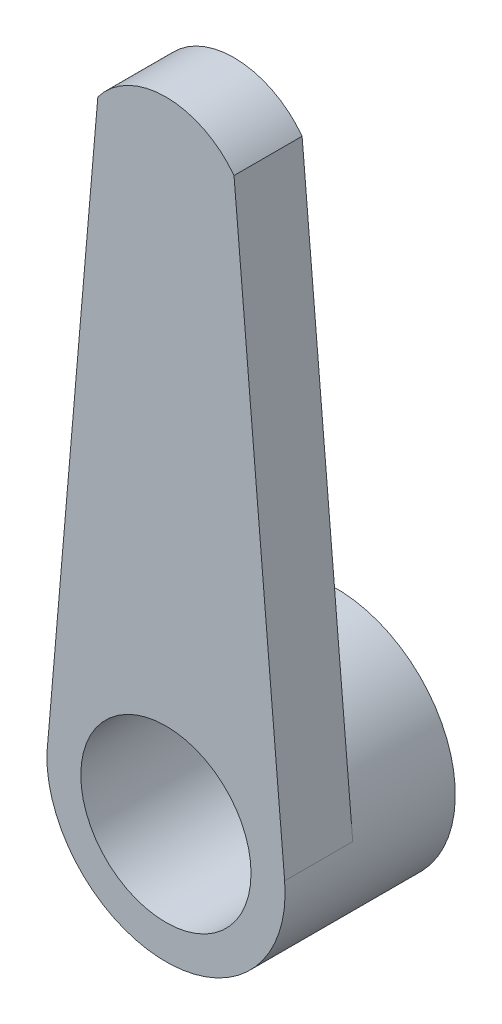
from build123d import *
from build123d.topology import SkipClean

# Parameters (mm, degrees)
BOSS_EXTRUDE1_DEPTH      = 2
BOSS_EXTRUDE2_START      = 3
BOSS_EXTRUDE2_DEPTH      = 3
F_5_0_5_DIAMETER_HOLE1_D = 5


with BuildPart() as part:
    # Sketch1 → Boss-Extrude1 (new body)
    with BuildSketch(Plane(origin=(0, 0, -2), x_dir=(-1, 0, 0), z_dir=(0, 0, -1))):
        with BuildLine():
            Line((-2, 17.5), (-3.486991, 0.301487))
            ThreePointArc((-3.486991, 0.301487), (-0.150884, -3.496746), (3.5, 0))
            Line((3.5, 0), (2, 17.5))
            ThreePointArc((2, 17.5), (0, 18.5), (-2, 17.5))
        make_face()
    extrude(amount=-BOSS_EXTRUDE1_DEPTH)

    # Sketch2 → Boss-Extrude2 (add)
    with SkipClean():  # the faces are left unmerged after this step: merging them gives an invalid solid
        with BuildSketch(Plane(origin=(0, 0, -2), x_dir=(-1, 0, 0), z_dir=(0, 0, -1)).offset(BOSS_EXTRUDE2_START)):
            with BuildLine():
                Line((3.448947, 0.595624), (3.5, 0))
                ThreePointArc((3.5, 0), (-3.487213, -0.298904), (3.448947, 0.595624))
            make_face()
        extrude(amount=-BOSS_EXTRUDE2_DEPTH)

    # Ø5.0 (5) Diameter Hole1 (through all)
    with Locations(Plane(origin=(0, 0, -5), x_dir=(-1, 0, 0), z_dir=(0, 0, -1))):
        with Locations((0, 0)):
            Hole(F_5_0_5_DIAMETER_HOLE1_D / 2)


solid = part.part
